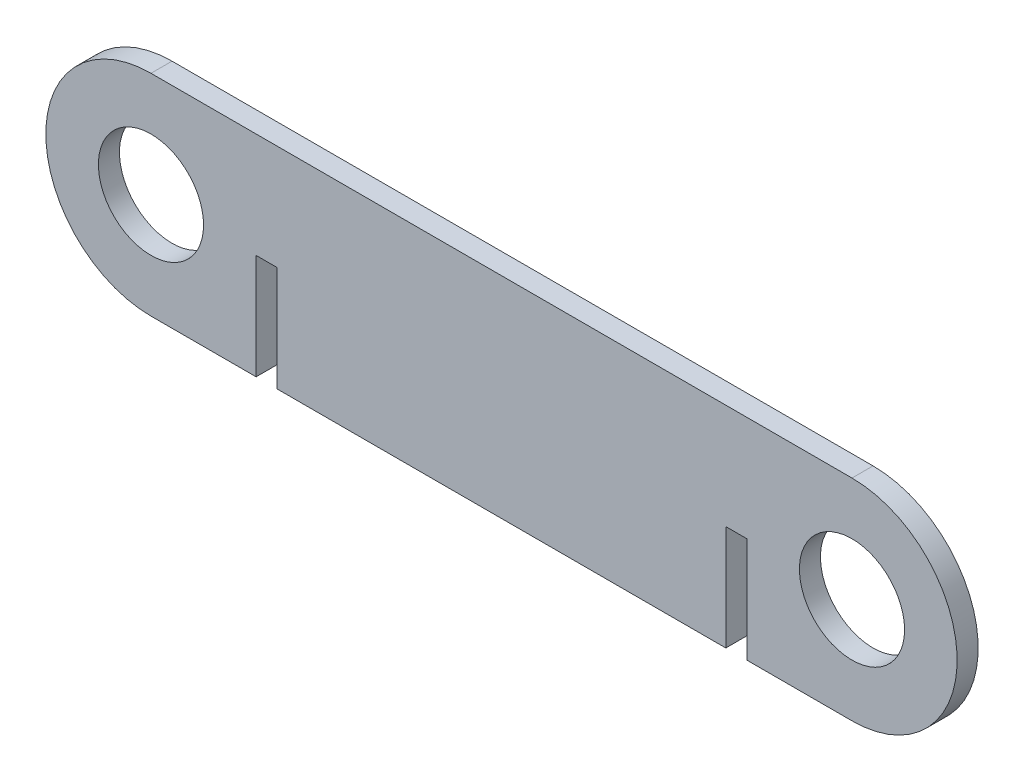
from build123d import *

# Parameters (mm, degrees)
BOSS_EXTRUDE1_DEPTH = 3
SKETCH2_W           = 3
SKETCH2_H           = 15
CUT_EXTRUDE1_DEPTH  = 3
SKETCH3_R           = 7.5
CUT_EXTRUDE2_DEPTH  = 3


with BuildPart() as part:
    # Sketch1 → Boss-Extrude1 (new body)
    with BuildSketch(Plane.XY):
        with BuildLine():
            Line((10.455245645, 29.11454936), (110.455245645, 29.11454936))
            ThreePointArc((110.455245645, 29.11454936), (125.455245645, 14.11454936), (110.455245645, -0.88545064))
            Line((110.455245645, -0.88545064), (10.455245645, -0.88545064))
            ThreePointArc((10.455245645, -0.88545064), (-4.544754355, 14.11454936), (10.455245645, 29.11454936))
        make_face()
    extrude(amount=BOSS_EXTRUDE1_DEPTH)

    # Sketch2 → Cut-Extrude1 (cut)
    with BuildSketch(Plane.XY.offset(3)):
        with Locations((26.955245645, 6.61454936)):
            Rectangle(SKETCH2_W, SKETCH2_H)
        with Locations((93.955245645, 6.61454936)):
            Rectangle(SKETCH2_W, SKETCH2_H)
    extrude(amount=-CUT_EXTRUDE1_DEPTH, mode=Mode.SUBTRACT)

    # Sketch3 → Cut-Extrude2 (cut)
    with BuildSketch(Plane.XY.offset(3)):
        with Locations((10.455245645, 14.11454936)):
            Circle(SKETCH3_R)
        with Locations((110.455245645, 14.11454936)):
            Circle(SKETCH3_R)
    extrude(amount=-CUT_EXTRUDE2_DEPTH, mode=Mode.SUBTRACT)


solid = part.part
